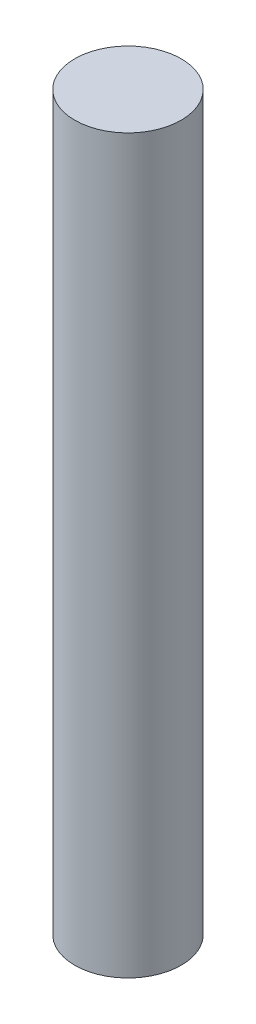
from build123d import *

# Parameters (mm, degrees)
SKETCH1_R           = 4
BOSS_EXTRUDE1_DEPTH = 55


with BuildPart() as part:
    # Sketch1 → Boss-Extrude1 (new body)
    with BuildSketch(Plane(origin=(0, 0, 0), x_dir=(1, 0, 0), z_dir=(0, 1, 0))):
        with Locations(Location((0, 0, 0), (0, 0, 270))):
            Circle(SKETCH1_R)
    extrude(amount=BOSS_EXTRUDE1_DEPTH)


solid = part.part
